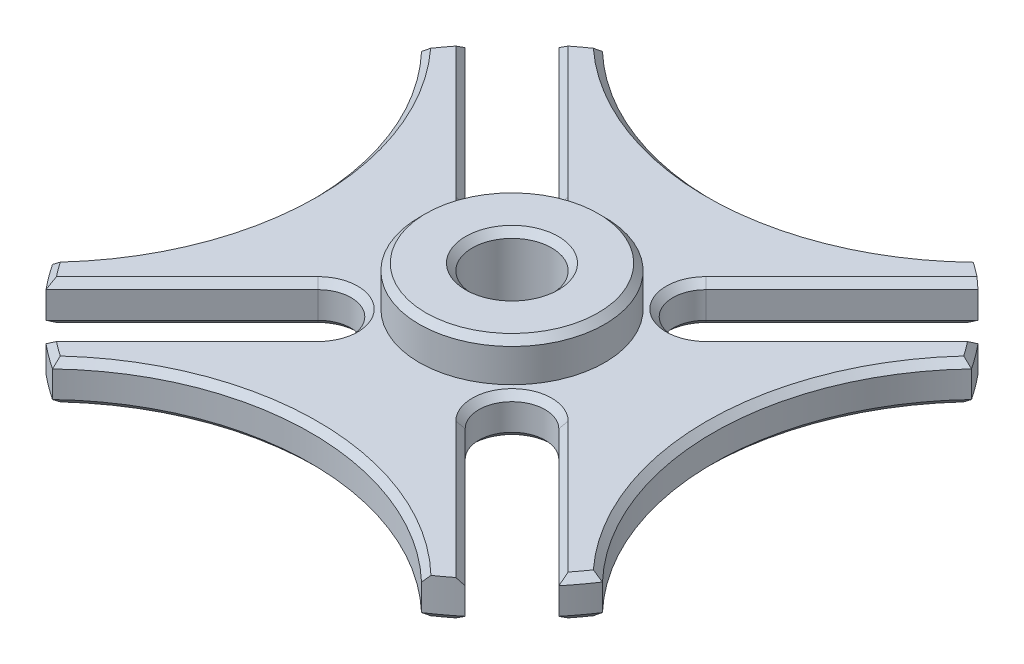
from build123d import *

# Parameters (mm, degrees)
SKETCH1_R           = 3
BOSS_EXTRUDE1_DEPTH = 3
SKETCH2_R           = 7
SKETCH2_R_2         = 3
BOSS_EXTRUDE2_DEPTH = 3
CHAMFER1_SIZE       = 0.5


with BuildPart() as part:
    # Sketch1 → Boss-Extrude1 (new body)
    with BuildSketch(Plane(origin=(0, 0, 0), x_dir=(1, 0, 0), z_dir=(0, 1, 0))):
        with BuildLine():
            ThreePointArc((9.090097423, 5.554563517), (5.554563517, 5.554563517), (5.554563517, 9.090097423))
            Line((5.554563517, 9.090097423), (15.821292146, 19.356826052))
            ThreePointArc((15.821292146, 19.356826052), (14.892716162, 20.080015073), (13.931131824, 20.758698564))
            ThreePointArc((13.931131824, 20.758698564), (0, 15.17766953), (-13.931131824, 20.758698564))
            ThreePointArc((-13.931131824, 20.758698564), (-14.892716162, 20.080015073), (-15.821292146, 19.356826052))
            Line((-15.821292146, 19.356826052), (-5.554563517, 9.090097423))
            ThreePointArc((-5.554563517, 9.090097423), (-5.554563517, 5.554563517), (-9.090097423, 5.554563517))
            Line((-9.090097423, 5.554563517), (-19.356826052, 15.821292146))
            ThreePointArc((-19.356826052, 15.821292146), (-20.080015073, 14.892716162), (-20.758698564, 13.931131824))
            ThreePointArc((-20.758698564, 13.931131824), (-15.17766953, 0), (-20.758698564, -13.931131824))
            ThreePointArc((-20.758698564, -13.931131824), (-20.080015073, -14.892716162), (-19.356826052, -15.821292146))
            Line((-19.356826052, -15.821292146), (-9.090097423, -5.554563517))
            ThreePointArc((-9.090097423, -5.554563517), (-5.554563517, -5.554563517), (-5.554563517, -9.090097423))
            Line((-5.554563517, -9.090097423), (-15.821292146, -19.356826052))
            ThreePointArc((-15.821292146, -19.356826052), (-14.892716162, -20.080015073), (-13.931131824, -20.758698564))
            ThreePointArc((-13.931131824, -20.758698564), (0, -15.17766953), (13.931131824, -20.758698564))
            ThreePointArc((13.931131824, -20.758698564), (14.892716162, -20.080015073), (15.821292146, -19.356826052))
            Line((15.821292146, -19.356826052), (5.554563517, -9.090097423))
            ThreePointArc((5.554563517, -9.090097423), (5.554563517, -5.554563517), (9.090097423, -5.554563517))
            Line((9.090097423, -5.554563517), (19.356826052, -15.821292146))
            ThreePointArc((19.356826052, -15.821292146), (20.080015073, -14.892716162), (20.758698564, -13.931131824))
            ThreePointArc((20.758698564, -13.931131824), (15.17766953, 0), (20.758698564, 13.931131824))
            ThreePointArc((20.758698564, 13.931131824), (20.080015073, 14.892716162), (19.356826052, 15.821292146))
            Line((19.356826052, 15.821292146), (9.090097423, 5.554563517))
        make_face()
        with Locations(Location((0, 0, 0), (0, 0, 270))):
            Circle(SKETCH1_R, mode=Mode.SUBTRACT)
    extrude(amount=BOSS_EXTRUDE1_DEPTH)

    # Sketch2 → Boss-Extrude2 (add)
    with BuildSketch(Plane(origin=(0, 3, 0), x_dir=(1, 0, 0), z_dir=(0, 1, 0))):
        with Locations(Location((0, 0, 0), (0, 0, 270))):
            Circle(SKETCH2_R)
        with Locations(Location((0, 0, 0), (0, 0, 270))):
            Circle(SKETCH2_R_2, mode=Mode.SUBTRACT)
    extrude(amount=BOSS_EXTRUDE2_DEPTH)

    # Chamfer1
    chamfer1_edges = [part.edges().sort_by_distance(p)[0] for p in [
        (0, 6, -7),
        (10.687927832, 3, 14.223461738),
        (5.554563517, 3, 5.554563517),
        (14.223461738, 3, 10.687927832),
        (20.080015073, 3, 14.892716162),
        (15.17766953, 3, 0),
        (20.080015073, 3, -14.892716162),
        (14.223461738, 3, -10.687927832),
        (5.554563517, 3, -5.554563517),
        (10.687927832, 3, -14.223461738),
        (0, 3, 15.17766953),
        (-14.892716162, 3, 20.080015073),
        (-10.687927832, 3, 14.223461738),
        (-5.554563517, 3, 5.554563517),
        (-14.223461738, 3, 10.687927832),
        (-20.080015073, 3, 14.892716162),
        (-15.17766953, 3, 0),
        (-20.080015073, 3, -14.892716162),
        (0, 3, -15.17766953),
        (-14.892716162, 3, -20.080015073),
        (-10.687927832, 3, -14.223461738),
        (-5.554563517, 3, -5.554563517),
        (-14.223461738, 3, -10.687927832),
        (0, 6, -3),
        (0, 0, -3),
        (20.080015073, 0, 14.892716162),
        (14.223461738, 0, 10.687927832),
        (5.554563517, 0, 5.554563517),
        (10.687927832, 0, 14.223461738),
        (14.892716162, 0, 20.080015073),
        (0, 0, 15.17766953),
        (-14.892716162, 0, 20.080015073),
        (-10.687927832, 0, 14.223461738),
        (-5.554563517, 0, 5.554563517),
        (-14.223461738, 0, 10.687927832),
        (-20.080015073, 0, 14.892716162),
        (-15.17766953, 0, 0),
        (-20.080015073, 0, -14.892716162),
        (-14.223461738, 0, -10.687927832),
        (-5.554563517, 0, -5.554563517),
        (-10.687927832, 0, -14.223461738),
        (-14.892716162, 0, -20.080015073),
        (0, 0, -15.17766953),
        (14.892716162, 0, -20.080015073),
        (10.687927832, 0, -14.223461738),
        (5.554563517, 0, -5.554563517),
        (14.223461738, 0, -10.687927832),
        (20.080015073, 0, -14.892716162),
        (15.17766953, 0, 0),
    ]]
    chamfer(chamfer1_edges, length=CHAMFER1_SIZE)


solid = part.part
